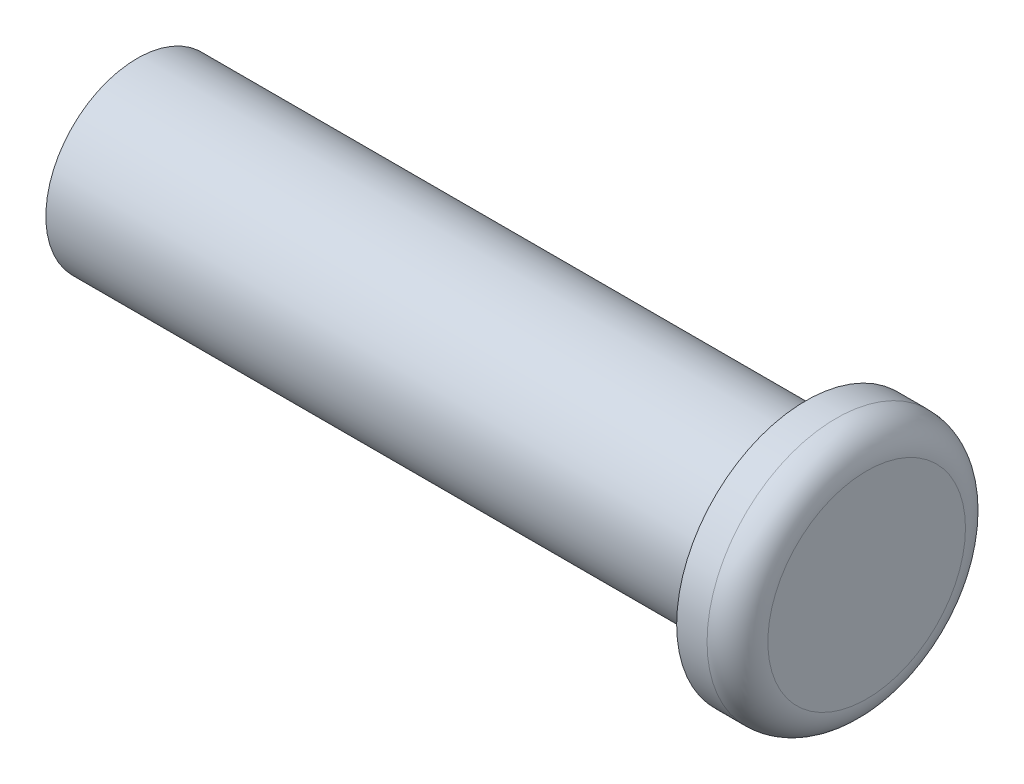
from build123d import *

# Parameters (mm, degrees)
SKETCH2_R           = 3
BOSS_EXTRUDE1_DEPTH = 11
SKETCH3_R           = 4.25
BOSS_EXTRUDE2_DEPTH = 2
FILLET2_R           = 1


with BuildPart() as part:
    # Sketch2 → Boss-Extrude1 (new, symmetric)
    with BuildSketch(Plane(origin=(0, 0, 0), x_dir=(0, 0, -1), z_dir=(1, 0, 0))):
        Circle(SKETCH2_R)
    extrude(amount=BOSS_EXTRUDE1_DEPTH, both=True)

    # Sketch3 → Boss-Extrude2 (add)
    with BuildSketch(Plane(origin=(11, 0, 0), x_dir=(0, 0, -1), z_dir=(1, 0, 0))):
        Circle(SKETCH3_R)
    extrude(amount=BOSS_EXTRUDE2_DEPTH)

    # Fillet2
    fillet2_edges = [part.edges().sort_by_distance(p)[0] for p in [
        (13, 0, 4.25),
    ]]
    fillet(fillet2_edges, radius=FILLET2_R)


solid = part.part
